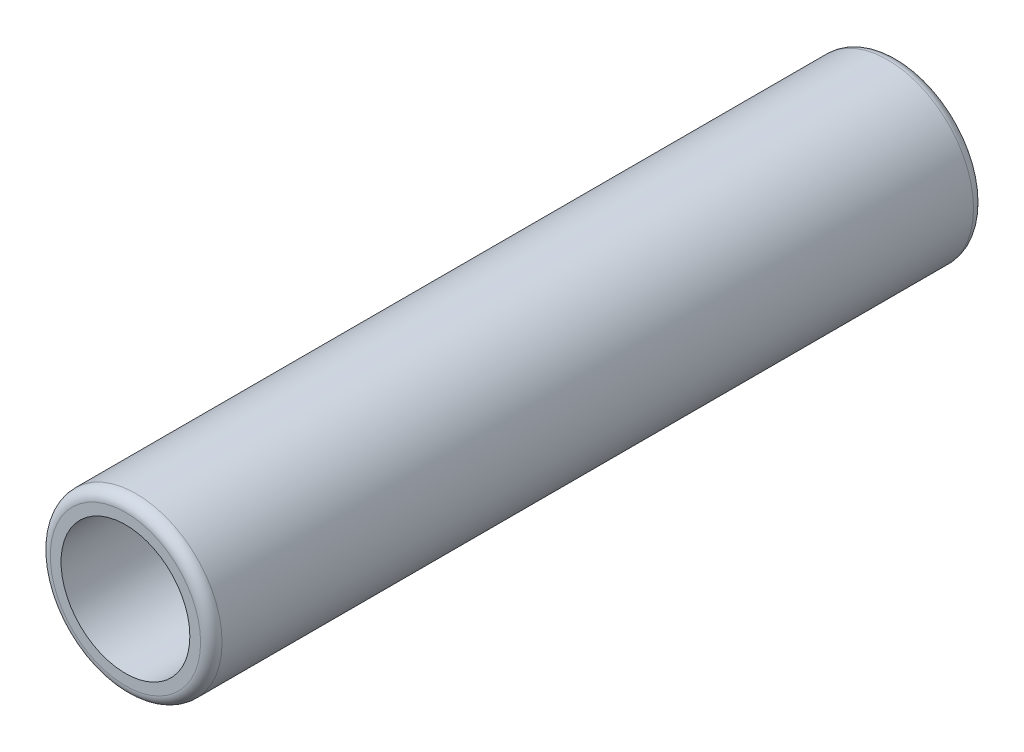
from build123d import *

# Parameters (mm, degrees)
SKETCH_1_R      = 4
SKETCH_1_R_2    = 3
EXTRUDE_1_DEPTH = 36
FILLET_1_R      = 0.5


with BuildPart() as part:
    # Эскиз1 → Бобышка-Вытянуть1 (new body)
    with BuildSketch(Plane.XY):
        Circle(SKETCH_1_R)
        Circle(SKETCH_1_R_2, mode=Mode.SUBTRACT)
    extrude(amount=EXTRUDE_1_DEPTH)

    # Скругление1
    fillet_1_edges = [part.edges().sort_by_distance(p)[0] for p in [
        (-4, 0, 0),
        (-4, 0, 36),
    ]]
    fillet(fillet_1_edges, radius=FILLET_1_R)


solid = part.part
